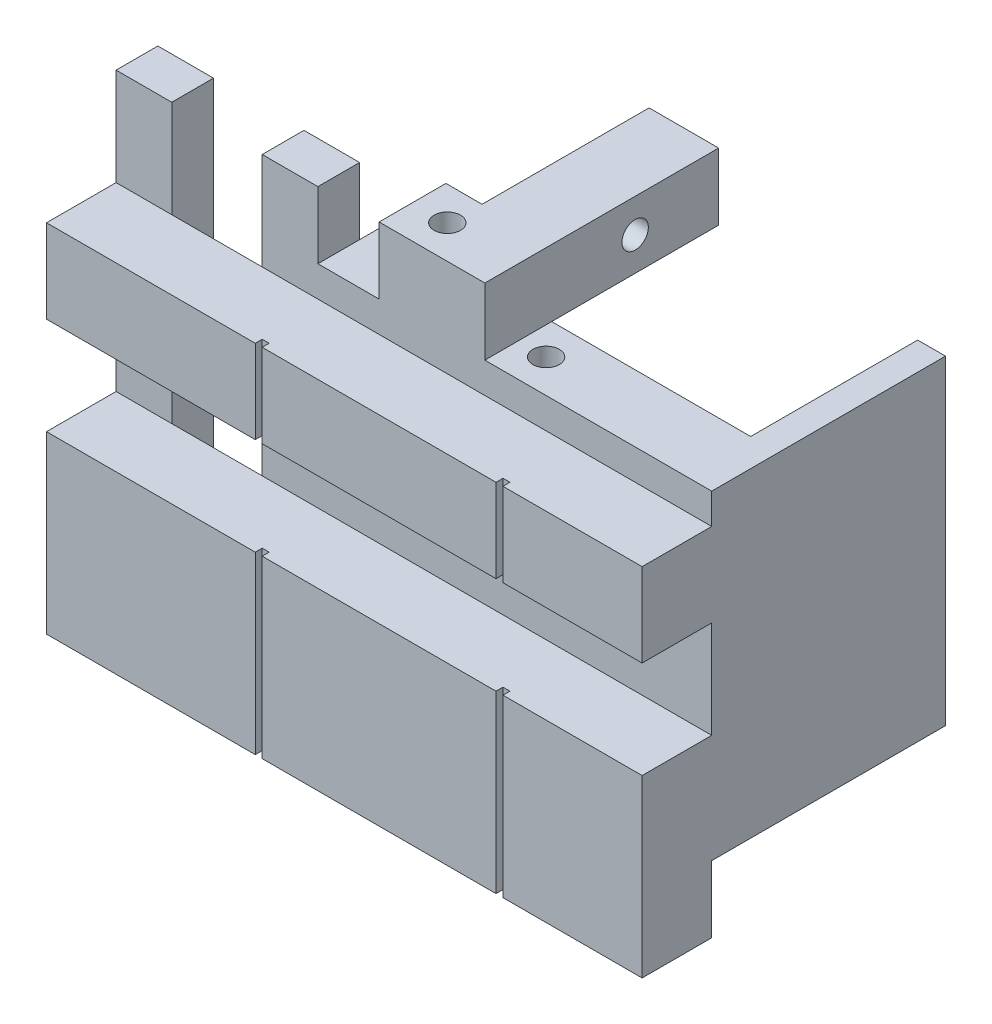
from build123d import *

# Parameters (mm, degrees)
EXTRUDE_1_DEPTH          = 4.8
SKETCH_2_W               = 2
SKETCH_2_H               = 23
SKETCH_2_W_2             = 5
SKETCH_2_H_2             = 4.8
EXTRUDE_2_DEPTH          = 12
SKETCH_3_R               = 0.95
CUT_EXTRUDE_1_DEPTH      = 5
SKETCH_6_R               = 0.95
CUT_EXTRUDE_4_DEPTH      = 32
SKETCH_8_W               = 42.8
SKETCH_8_H               = 6
SKETCH_8_H_2             = 12.6
EXTRUDE_3_DEPTH          = 5
SKETCH_9_W               = 4
SKETCH_9_H               = 32.6
EXTRUDE_4_DEPTH          = 3
CUT_EXTRUDE_5_DEPTH      = 44.080970277
CUT_EXTRUDE_5_DEPTH_BACK = 44.080970277
SKETCH_11_R              = 0.95
SKETCH_12_W              = 0.5
SKETCH_12_H              = 25.6
CUT_EXTRUDE_6_DEPTH      = 0.5


with BuildPart() as part:
    # 草图1 → 凸台-拉伸1 (new body)
    with BuildSketch(Plane.XY):
        Polygon((12, 0), (28.3, 0), (28.3, -23), (12, -23), (12, -27.8), (4.4, -27.8), (4.4, -23), (0, -23), (0, 0), (4.4, 0), (4.4, 4.8), (12, 4.8), align=None)
    extrude(amount=-EXTRUDE_1_DEPTH)

    # 草图2 → 凸台-拉伸2 (add)
    with BuildSketch(Plane(origin=(0, 0, -4.8), x_dir=(-1, 0, 0), z_dir=(0, 0, -1))):
        with Locations((-27.3, -11.5)):
            Rectangle(SKETCH_2_W, SKETCH_2_H)
        with Locations((-9.5, -25.4)):
            Rectangle(SKETCH_2_W_2, SKETCH_2_H_2)
        with Locations((-9.5, 2.4)):
            Rectangle(SKETCH_2_W_2, SKETCH_2_H_2)
    extrude(amount=EXTRUDE_2_DEPTH)

    # 草图3 → 切除-拉伸1 (cut)
    with BuildSketch(Plane.ZY.offset(-7)):
        with Locations((-10.8, 2.4)):
            Circle(SKETCH_3_R)
        with Locations((-10.8, -25.4)):
            Circle(SKETCH_3_R)
    extrude(amount=-CUT_EXTRUDE_1_DEPTH, mode=Mode.SUBTRACT)

    # 草图6 → 切除-拉伸4 (cut)
    with BuildSketch(Plane(origin=(0, 0, 0), x_dir=(1, 0, 0), z_dir=(0, 1, 0))):
        with Locations(Location((14, 2.4, 0), (0, 0, 270))):
            Circle(SKETCH_6_R)
    extrude(amount=-CUT_EXTRUDE_4_DEPTH, mode=Mode.SUBTRACT)

    # 草图8 → 凸台-拉伸3 (add)
    with BuildSketch(Plane.XY):
        with Locations((6.9, -5.2)):
            Rectangle(SKETCH_8_W, SKETCH_8_H)
        with Locations((6.9, -21.5)):
            Rectangle(SKETCH_8_W, SKETCH_8_H_2)
    extrude(amount=EXTRUDE_3_DEPTH)

    # 草图9 → 凸台-拉伸4 (add)
    with BuildSketch(Plane(origin=(0, 0, 0), x_dir=(-1, 0, 0), z_dir=(0, 0, -1))):
        with Locations((2, -11.5)):
            Rectangle(SKETCH_9_W, SKETCH_9_H)
        with Locations((12.5, -11.5)):
            Rectangle(SKETCH_9_W, SKETCH_9_H)
    extrude(amount=EXTRUDE_4_DEPTH)

    # 草图11 → 切除-拉伸5 (cut, two sides: drawn at the far end of the back side and taken through both)
    with BuildSketch(Plane(origin=(0, -23, 0), x_dir=(-1, 0, 0), z_dir=(0, -1, 0)).offset(-CUT_EXTRUDE_5_DEPTH_BACK)):
        with Locations(Location((-6.9, 2.4, 0), (0, 0, 90))):
            Circle(SKETCH_11_R)
    extrude(amount=CUT_EXTRUDE_5_DEPTH + CUT_EXTRUDE_5_DEPTH_BACK, mode=Mode.SUBTRACT)

    # 草图12 → 切除-拉伸6 (cut)
    with BuildSketch(Plane.XY.offset(5)):
        with Locations((0.75, -15)):
            Rectangle(SKETCH_12_W, SKETCH_12_H)
        with Locations((18.05, -15)):
            Rectangle(SKETCH_12_W, SKETCH_12_H)
    extrude(amount=-CUT_EXTRUDE_6_DEPTH, mode=Mode.SUBTRACT)


solid = part.part
